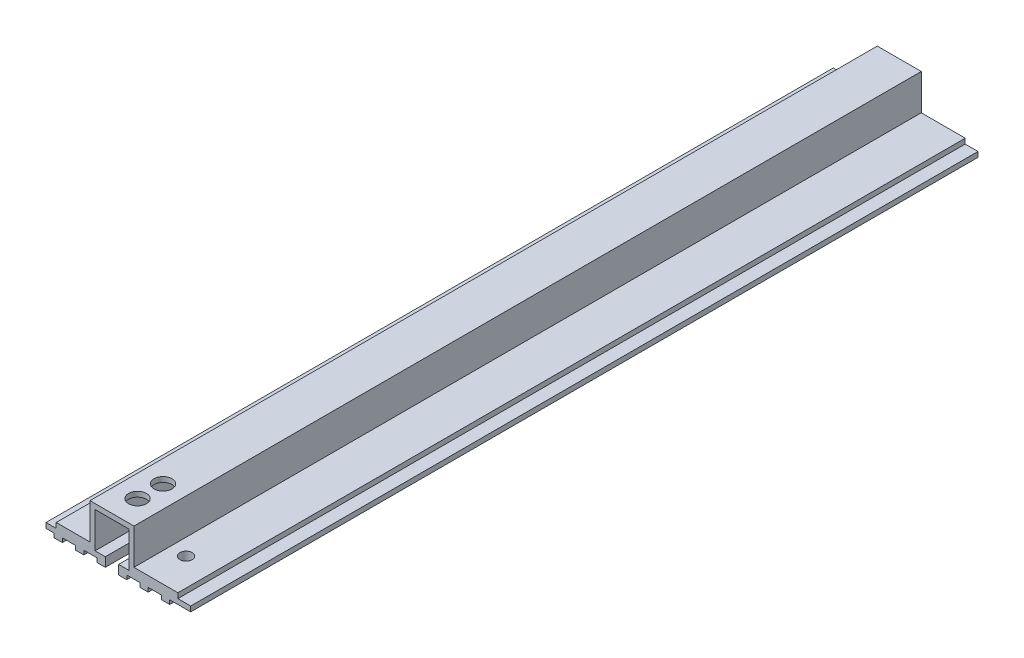
from build123d import *

# Parameters (mm, degrees)
BOSS_EXTRUDE1_DEPTH = 195.58
CUT_EXTRUDE1_REACH  = 201.244
SKETCH2_R           = 2.2225
SKETCH5_R           = 1.524
CUT_EXTRUDE4_DEPTH  = 200.053570631


with BuildPart() as part:
    # Sketch1 → Boss-Extrude1 (new body)
    with BuildSketch(Plane.XY):
        Polygon((0, 0), (2.032, 0), (2.032, -1.016), (4.064, -1.016), (4.064, 0), (7.366, 0), (7.366, -1.016), (9.398, -1.016), (9.398, 0), (12.7, 0), (12.7, -1.016), (14.732, -1.016), (14.732, 0), (14.732, 1.27), (12.192, 1.27), (12.192, 10.16), (20.574, 10.16), (20.574, 1.27), (18.034, 1.27), (18.034, 0), (18.034, -1.016), (20.066, -1.016), (20.066, 0), (23.368, 0), (23.368, -1.016), (25.4, -1.016), (25.4, 0), (28.702, 0), (28.702, -1.016), (30.734, -1.016), (30.734, 0), (32.766, 0), (35.941, 0), (35.941, 1.27), (32.766, 1.27), (32.766, 2.54), (30.226, 2.54), (21.844, 2.54), (21.844, 11.43), (10.922, 11.43), (10.922, 2.54), (2.54, 2.54), (2.54, 1.27), (0, 1.27), align=None)
    extrude(amount=-BOSS_EXTRUDE1_DEPTH)

    # Sketch2 → Cut-Extrude1 (cut, up to next)
    with BuildSketch(Plane(origin=(0, 11.43, 0), x_dir=(1, 0, 0), z_dir=(0, 1, 0)), mode=Mode.PRIVATE) as cut_extrude1_sk1:
        with Locations(Location((16.383, 6.35, 0), (0, 0, 270))):
            Circle(SKETCH2_R)
    cut_extrude1_tool1 = extrude(cut_extrude1_sk1.sketch, amount=-CUT_EXTRUDE1_REACH, mode=Mode.PRIVATE) & part.part
    # Sketch2 → Cut-Extrude1 (cut, up to next)
    with BuildSketch(Plane(origin=(0, 11.43, 0), x_dir=(1, 0, 0), z_dir=(0, 1, 0)), mode=Mode.PRIVATE) as cut_extrude1_sk2:
        with Locations(Location((16.383, 12.7, 0), (0, 0, 270))):
            Circle(SKETCH2_R)
    cut_extrude1_tool2 = extrude(cut_extrude1_sk2.sketch, amount=-CUT_EXTRUDE1_REACH, mode=Mode.PRIVATE) & part.part
    add(cut_extrude1_tool1.solids().sort_by_distance((16.383, 11.43, -6.35))[0], mode=Mode.SUBTRACT)
    add(cut_extrude1_tool2.solids().sort_by_distance((16.383, 11.43, -12.7))[0], mode=Mode.SUBTRACT)

    # Sketch5 → Cut-Extrude4 (cut, through all)
    with BuildSketch(Plane(origin=(0, 2.54, 0), x_dir=(1, 0, 0), z_dir=(0, 1, 0))):
        with Locations(Location((25.908, 8.89, 0), (0, 0, 180))):
            Circle(SKETCH5_R)
    extrude(amount=-CUT_EXTRUDE4_DEPTH, mode=Mode.SUBTRACT)


solid = part.part
